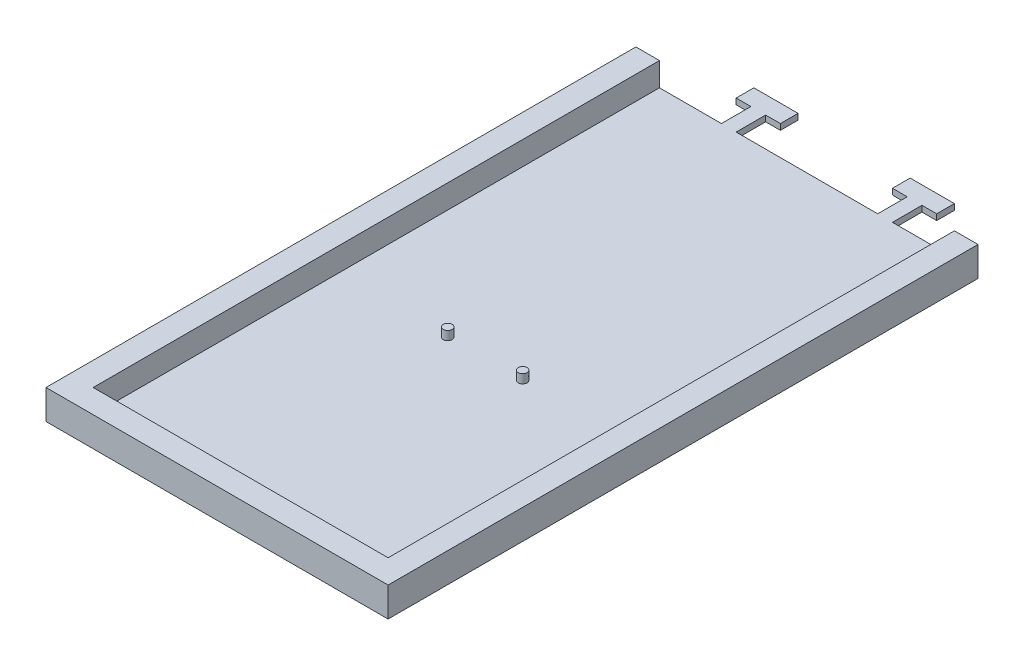
from build123d import *

# Parameters (mm, degrees)
SKETCH3_W               = 116
SKETCH3_H               = 416
BOSS_EXTRUDE1_DEPTH     = 10
SKETCH4_W               = 100
SKETCH4_H               = 400
CUT_EXTRUDE1_DEPTH      = 8
SKETCH6_W               = 3
SKETCH6_H               = 100
BOSS_EXTRUDE4_DEPTH     = 3
SKETCH7_R               = 1.5
BOSS_EXTRUDE5_DEPTH     = 3
CUT_EXTRUDE3_DEPTH      = 10
CUT_EXTRUDE3_DEPTH_BACK = 10
SKETCH8_W               = 116
SKETCH8_H               = 200
CUT_EXTRUDE4_DEPTH      = 10
SKETCH11_W              = 8
SKETCH11_H              = 16
CUT_EXTRUDE5_DEPTH      = 10
SKETCH13_R              = 1.5
BOSS_EXTRUDE8_DEPTH     = 3


with BuildPart() as part:
    # Sketch3 → Boss-Extrude1 (new body)
    with BuildSketch(Plane(origin=(0, 0, 0), x_dir=(1, 0, 0), z_dir=(0, 1, 0))):
        with Locations((-1098.104867157, 569.267379684)):
            Rectangle(SKETCH3_W, SKETCH3_H)
    extrude(amount=BOSS_EXTRUDE1_DEPTH)

    # Sketch4 → Cut-Extrude1 (cut)
    with BuildSketch(Plane(origin=(0, 10, 0), x_dir=(1, 0, 0), z_dir=(0, 1, 0))):
        with Locations((-1098.104867157, 569.267379684)):
            Rectangle(SKETCH4_W, SKETCH4_H)
    extrude(amount=-CUT_EXTRUDE1_DEPTH, mode=Mode.SUBTRACT)

    # Sketch6 → Boss-Extrude4 (add)
    with BuildSketch(Plane(origin=(0, 2, 0), x_dir=(1, 0, 0), z_dir=(0, 1, 0))):
        with Locations((-1129.604867157, 719.267379684)):
            Rectangle(SKETCH6_W, SKETCH6_H)
        with Locations((-1066.604867157, 719.267379684)):
            Rectangle(SKETCH6_W, SKETCH6_H)
    extrude(amount=BOSS_EXTRUDE4_DEPTH)

    # Sketch7 → Boss-Extrude5 (add)
    with BuildSketch(Plane(origin=(0, 2, 0), x_dir=(1, 0, 0), z_dir=(0, 1, 0))):
        with Locations(Location((-1085.404867157, 452.168271652, 0), (0, 0, 270))):
            Circle(SKETCH7_R)
    extrude(amount=BOSS_EXTRUDE5_DEPTH)

    # Sketch8 → Cut-Extrude3 (cut, two sides: drawn at the far end of the back side and taken through both)
    with BuildSketch(Plane(origin=(0, 2, 0), x_dir=(1, 0, 0), z_dir=(0, 1, 0)).offset(-CUT_EXTRUDE3_DEPTH_BACK)):
        with Locations((-1098.104867157, 677.267379684)):
            Rectangle(SKETCH8_W, SKETCH8_H)
    extrude(amount=CUT_EXTRUDE3_DEPTH + CUT_EXTRUDE3_DEPTH_BACK, mode=Mode.SUBTRACT)

    # Sketch9 → Cut-Extrude4 (cut)
    with BuildSketch(Plane(origin=(0, 2, 0), x_dir=(1, 0, 0), z_dir=(0, 1, 0))):
        Polygon((-1156.104867157, 577.267379684), (-1156.104867157, 561.267379684), (-1127.104867157, 561.267379684), (-1127.104867157, 571.267379684), (-1132.104867157, 571.267379684), (-1132.104867157, 577.267379684), align=None)
        Polygon((-1079.104867157, 577.267379684), (-1117.104867157, 577.267379684), (-1117.104867157, 571.267379684), (-1122.104867157, 571.267379684), (-1122.104867157, 561.267379684), (-1074.104867157, 561.267379684), (-1074.104867157, 571.267379684), (-1079.104867157, 571.267379684), align=None)
        Polygon((-1069.104867157, 561.267379684), (-1048.104867157, 561.267379684), (-1048.104867157, 577.267379684), (-1064.104867157, 577.267379684), (-1064.104867157, 571.267379684), (-1069.104867157, 571.267379684), align=None)
    extrude(amount=-CUT_EXTRUDE4_DEPTH, mode=Mode.SUBTRACT)

    # Sketch11 → Cut-Extrude5 (cut)
    with BuildSketch(Plane(origin=(0, 10, 0), x_dir=(1, 0, 0), z_dir=(0, 1, 0))):
        with Locations((-1152.104867157, 569.267379684)):
            Rectangle(SKETCH11_W, SKETCH11_H)
        with Locations((-1044.104867157, 569.267379684)):
            Rectangle(SKETCH11_W, SKETCH11_H)
    extrude(amount=-CUT_EXTRUDE5_DEPTH, mode=Mode.SUBTRACT)

    # Sketch13 → Boss-Extrude8 (add)
    with BuildSketch(Plane(origin=(0, 2, 0), x_dir=(1, 0, 0), z_dir=(0, 1, 0))):
        with Locations(Location((-1110.804867157, 452.168271652, 0), (0, 0, 270))):
            Circle(SKETCH13_R)
    extrude(amount=BOSS_EXTRUDE8_DEPTH)


solid = part.part
